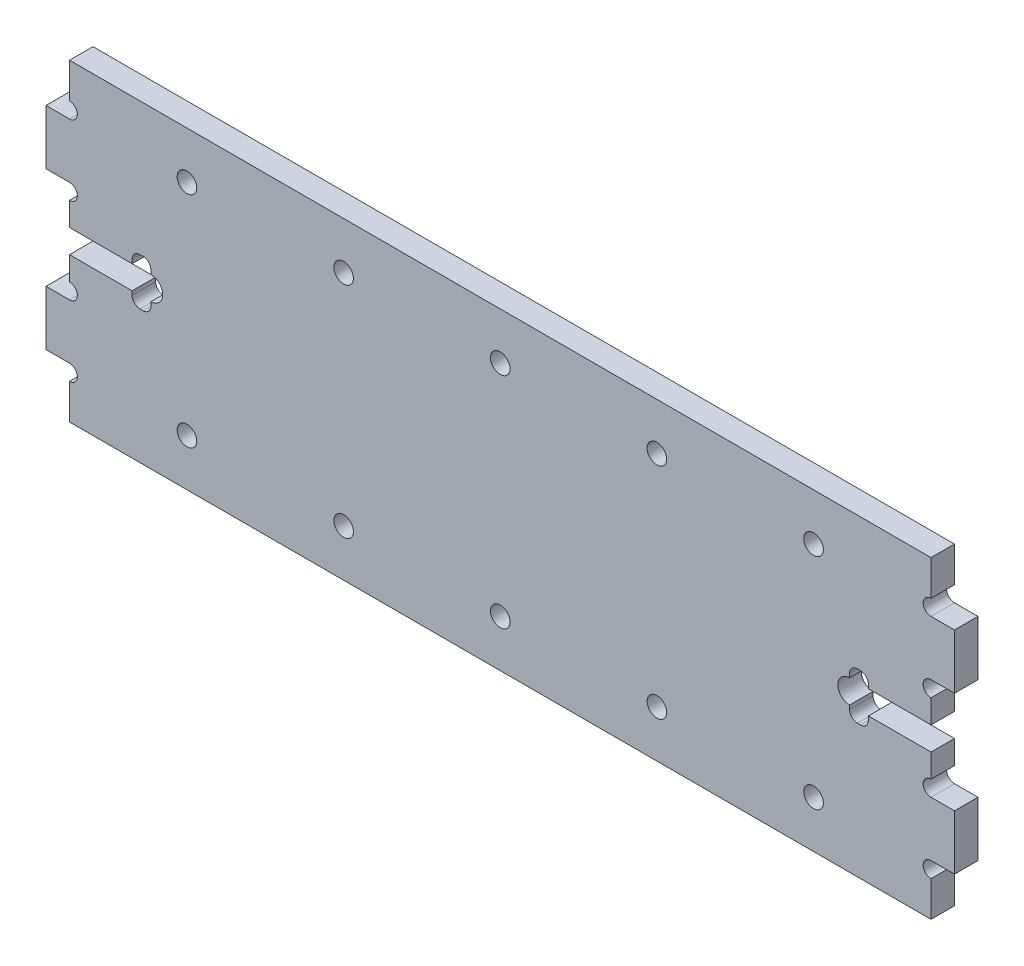
from build123d import *

# Parameters (mm, degrees)
SKETCH1_W           = 110
SKETCH1_H           = 40
BOSS_EXTRUDE1_DEPTH = 3
BOSS_EXTRUDE2_DEPTH = 3
SKETCH3_R           = 1
CUT_EXTRUDE1_DEPTH  = 3
SKETCH4_W           = 8
SKETCH4_H           = 3
SKETCH4_W_2         = 2.4
SKETCH4_H_2         = 6
CUT_EXTRUDE2_DEPTH  = 3
FILLET6_R           = 1
SKETCH6_R           = 1.25
CUT_EXTRUDE4_DEPTH  = 62.424750712


with BuildPart() as part:
    # Sketch1 → Boss-Extrude1 (new body)
    with BuildSketch(Plane.XY):
        Rectangle(SKETCH1_W, SKETCH1_H)
    extrude(amount=BOSS_EXTRUDE1_DEPTH)

    # Sketch2 → Boss-Extrude2 (add)
    with BuildSketch(Plane.XY.offset(3)):
        Polygon((58, 10), (58, 13.5), (55, 13.5), (55, 6.5), (58, 6.5), align=None)
        Polygon((55, -10), (55, -6.5), (58, -6.5), (58, -13.5), (55, -13.5), align=None)
        Polygon((-55, 6.5), (-55, 13.5), (-58, 13.5), (-58, 10), (-58, 6.5), align=None)
        Polygon((-55, -13.5), (-55, -10), (-55, -6.5), (-58, -6.5), (-58, -13.5), align=None)
    extrude(amount=-BOSS_EXTRUDE2_DEPTH)

    # Sketch3 → Cut-Extrude1 (cut)
    with BuildSketch(Plane.XY.offset(3)):
        with Locations((-55, 14.5)):
            Circle(SKETCH3_R)
        with Locations((-55, 5.5)):
            Circle(SKETCH3_R)
        with Locations((-55, -5.5)):
            Circle(SKETCH3_R)
        with Locations((-55, -14.5)):
            Circle(SKETCH3_R)
        with Locations((55, 14.5)):
            Circle(SKETCH3_R)
        with Locations((55, 5.5)):
            Circle(SKETCH3_R)
        with Locations((55, -5.5)):
            Circle(SKETCH3_R)
        with Locations((55, -14.5)):
            Circle(SKETCH3_R)
    extrude(amount=-CUT_EXTRUDE1_DEPTH, mode=Mode.SUBTRACT)

    # Sketch4 → Cut-Extrude2 (cut)
    with BuildSketch(Plane.XY.offset(3)):
        with Locations((-51, 0)):
            Rectangle(SKETCH4_W, SKETCH4_H)
        Polygon((-47, 3), (-47, 1.5), (-47, -1.5), (-47, -3), (-44.6, -3), (-44.6, -1.5), (-44.6, 1.5), (-44.6, 3), align=None)
        with BuildLine():
            ThreePointArc((-44.6, -1.5), (-43.1, 0), (-44.6, 1.5))
            Line((-44.6, 1.5), (-44.6, -1.5))
        make_face()
        with Locations((45.8, 0)):
            Rectangle(SKETCH4_W_2, SKETCH4_H_2)
        with BuildLine():
            Line((44.6, -1.5), (44.6, 1.5))
            ThreePointArc((44.6, 1.5), (43.1, 0), (44.6, -1.5))
        make_face()
        with Locations((51, 0)):
            Rectangle(SKETCH4_W, SKETCH4_H)
    extrude(amount=-CUT_EXTRUDE2_DEPTH, mode=Mode.SUBTRACT)

    # Fillet6
    fillet6_edges = [part.edges().sort_by_distance(p)[0] for p in [
        (-47, 3, 1.5),
        (-44.6, 3, 1.5),
        (-44.6, -3, 1.5),
        (-47, -3, 1.5),
        (47, 3, 1.5),
        (47, -3, 1.5),
        (44.6, -3, 1.5),
        (44.6, 3, 1.5),
    ]]
    fillet(fillet6_edges, radius=FILLET6_R)

    # Sketch6 → Cut-Extrude4 (cut, through all)
    with BuildSketch(Plane.XY.offset(3)):
        with Locations((-40, -14)):
            Circle(SKETCH6_R)
        with Locations((-20, -14)):
            Circle(SKETCH6_R)
        with Locations((0, -14)):
            Circle(SKETCH6_R)
        with Locations((20, -14)):
            Circle(SKETCH6_R)
        with Locations((40, -14)):
            Circle(SKETCH6_R)
        with Locations((40, 14)):
            Circle(SKETCH6_R)
        with Locations((20, 14)):
            Circle(SKETCH6_R)
        with Locations((0, 14)):
            Circle(SKETCH6_R)
        with Locations((-20, 14)):
            Circle(SKETCH6_R)
        with Locations((-40, 14)):
            Circle(SKETCH6_R)
    extrude(amount=-CUT_EXTRUDE4_DEPTH, mode=Mode.SUBTRACT)


solid = part.part
